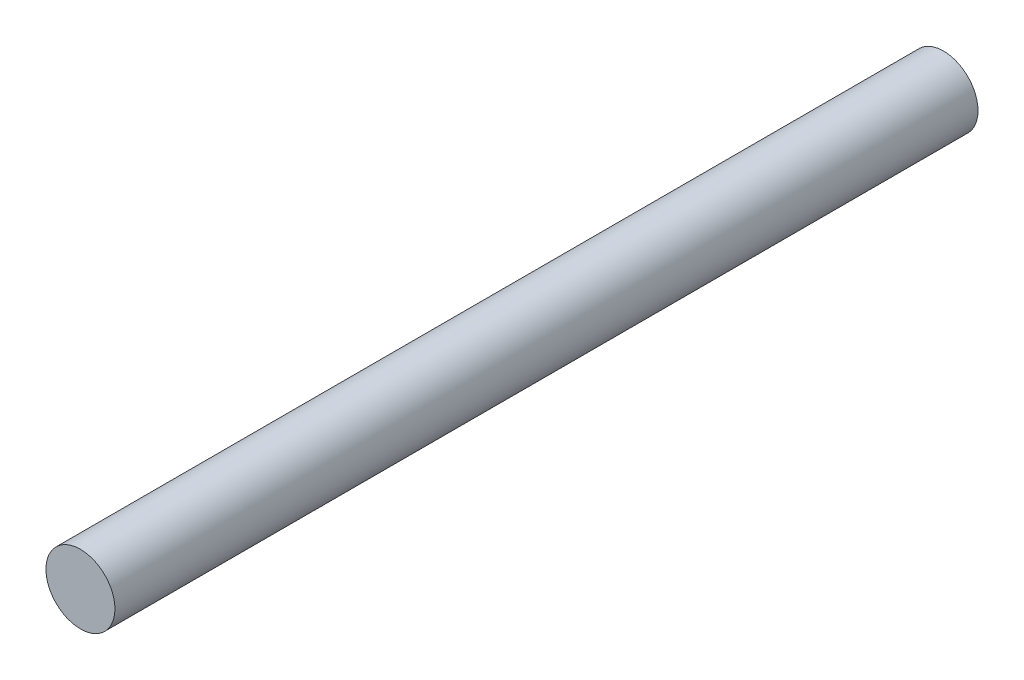
from build123d import *

# Parameters (mm, degrees)
SKETCH1_R           = 6.35
BOSS_EXTRUDE1_DEPTH = 158.877


with BuildPart() as part:
    # Sketch1 → Boss-Extrude1 (new body)
    with BuildSketch(Plane.XY):
        Circle(SKETCH1_R)
    extrude(amount=BOSS_EXTRUDE1_DEPTH)


solid = part.part
